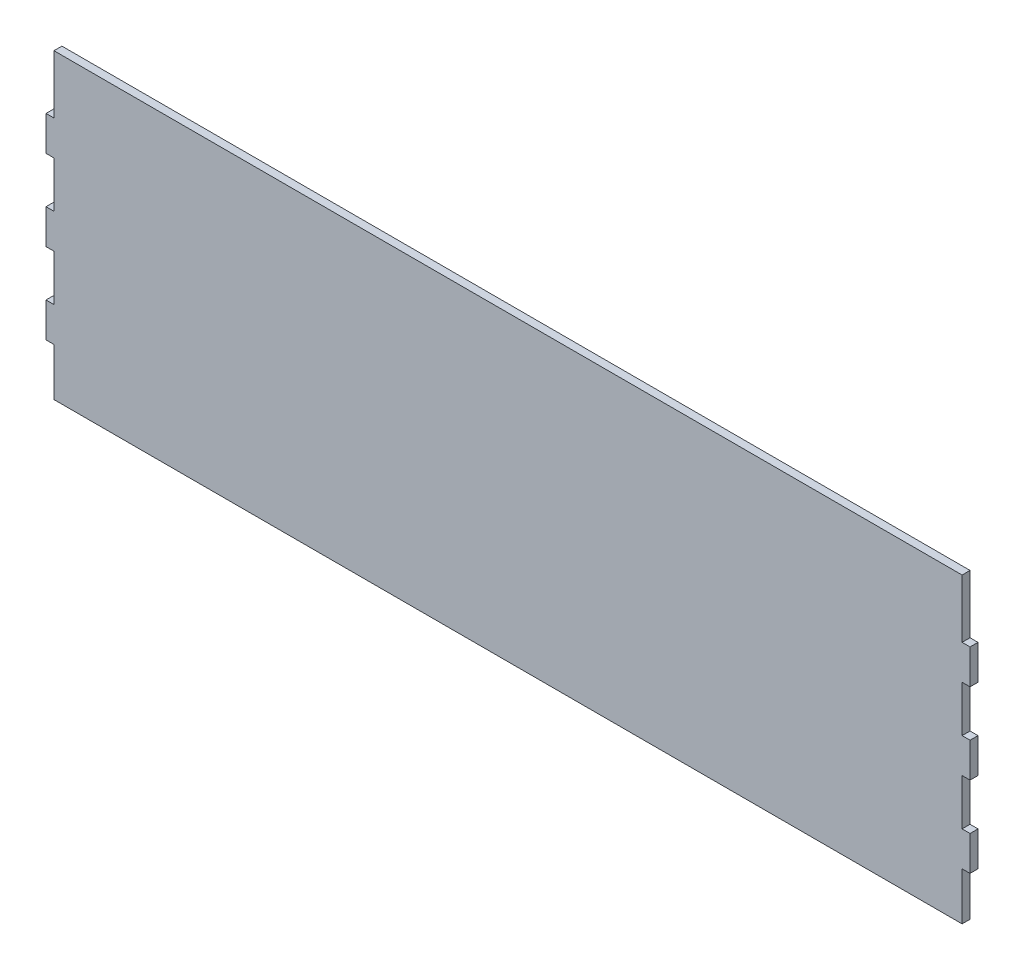
from build123d import *

# Parameters (mm, degrees)
CROQUIS1_W              = 348.64
CROQUIS1_H              = 110
SALIENTE_EXTRUIR1_DEPTH = 3
CROQUIS2_W              = 3
CROQUIS2_H              = 17.427708433
CORTAR_EXTRUIR1_DEPTH   = 3
CROQUIS4_W              = 342.64
CROQUIS4_H              = 4
SALIENTE_EXTRUIR3_DEPTH = 3
CROQUIS6_W              = 3.205128205
CROQUIS6_H              = 25
CORTAR_EXTRUIR4_DEPTH   = 1.5


with BuildPart() as part:
    # Croquis1 → Saliente-Extruir1 (new body)
    with BuildSketch(Plane.XY):
        Rectangle(CROQUIS1_W, CROQUIS1_H)
    extrude(amount=SALIENTE_EXTRUIR1_DEPTH)

    # Croquis2 → Cortar-Extruir1 (cut)
    with BuildSketch(Plane.XY.offset(3)):
        Polygon((-174.32, 55), (-174.32, 37), (-171.32, 37), (-171.32, 52), (-171.32, 55), align=None)
        with Locations((-172.82, 15.237951406)):
            Rectangle(CROQUIS2_W, CROQUIS2_H)
        Polygon((171.32, 55), (171.32, 52), (171.32, 37), (174.32, 37), (174.32, 55), align=None)
        with Locations((172.82, 15.237951406)):
            Rectangle(CROQUIS2_W, CROQUIS2_H)
        with Locations((172.82, -15.237951406)):
            Rectangle(CROQUIS2_W, CROQUIS2_H)
        Polygon((171.32, -37), (171.32, -52), (171.32, -55), (174.32, -55), (174.32, -37), align=None)
        with Locations((-172.82, -15.237951406)):
            Rectangle(CROQUIS2_W, CROQUIS2_H)
        Polygon((-171.32, -37), (-174.32, -37), (-174.32, -55), (-171.32, -55), (-171.32, -52), align=None)
    extrude(amount=-CORTAR_EXTRUIR1_DEPTH, mode=Mode.SUBTRACT)

    # Croquis4 → Saliente-Extruir3 (add)
    with BuildSketch(Plane(origin=(0, 0, 0), x_dir=(-1, 0, 0), z_dir=(0, 0, -1))):
        with Locations((0, 57)):
            Rectangle(CROQUIS4_W, CROQUIS4_H)
    extrude(amount=-SALIENTE_EXTRUIR3_DEPTH)

    # Croquis6 → Cortar-Extruir4 (cut)
    # profile 1 of 4: a face of its own
    with BuildSketch(Plane(origin=(0, 0, 0), x_dir=(-1, 0, 0), z_dir=(0, 0, -1))):
        with Locations((-55.769230769, 1.792158121)):
            Rectangle(CROQUIS6_W, CROQUIS6_H)
    # profile 2 of 4: a face of its own
    with BuildSketch(Plane(origin=(0, 0, 0), x_dir=(-1, 0, 0), z_dir=(0, 0, -1))):
        Polygon((-50, 11.728055557), (-50, 14.292158121), (-31.41025641, 14.292158121), (-31.41025641, 11.728055557), (-39.102564103, 11.728055557), (-39.102564103, -10.707841879), (-42.307692308, -10.707841879), (-42.307692308, 11.728055557), align=None)
    # profile 3 of 4: a face of its own
    with BuildSketch(Plane(origin=(0, 0, 0), x_dir=(-1, 0, 0), z_dir=(0, 0, -1))):
        Polygon((-12.179487179, 14.292158121), (3.846153846, -10.707841879), (0.310496795, -10.707841879), (-4.827724359, -2.695021367), (-20.177283654, -2.695021367), (-25.305488782, -10.707841879), (-28.846153846, -10.707841879), (-12.820512821, 14.292158121), align=None)
        Polygon((-12.5, 9.279137287), (-18.529647436, -0.130918802), (-6.470352564, -0.130918802), align=None, mode=Mode.SUBTRACT)
    # profile 4 of 4: a face of its own
    with BuildSketch(Plane(origin=(0, 0, 0), x_dir=(-1, 0, 0), z_dir=(0, 0, -1))):
        Polygon((7.692307692, -10.707841879), (12.329727564, 14.292158121), (13.090945513, 14.292158121), (26.762820513, -6.220662392), (40.389623397, 14.292158121), (41.17588141, 14.292158121), (45.833333333, -10.707841879), (42.608173077, -10.707841879), (39.262820513, 7.240876069), (27.338741987, -10.707841879), (26.231971154, -10.707841879), (14.262820513, 7.240876069), (10.932491987, -10.707841879), align=None)
    extrude(amount=-CORTAR_EXTRUIR4_DEPTH, mode=Mode.SUBTRACT)


solid = part.part
